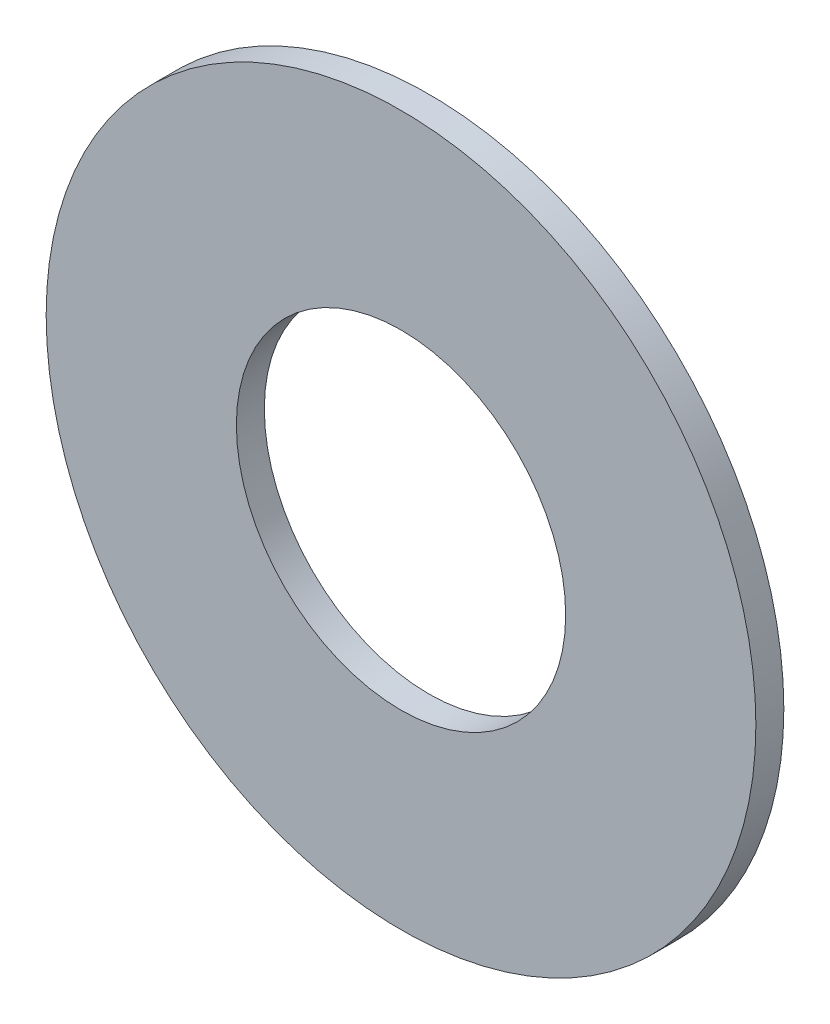
from build123d import *

# Parameters (mm, degrees)
BOSS_EXTRUDE1_DEPTH      = 0.4064
BOSS_EXTRUDE1_DEPTH_BACK = 0.4064
SKETCH3_R                = 10.31875
SKETCH3_R_2              = 4.7879


with BuildPart() as part:
    # Sketch3 → Boss-Extrude1 (new, two sides: drawn at the far end of the back side and taken through both)
    with BuildSketch(Plane.XY.offset(-BOSS_EXTRUDE1_DEPTH_BACK)):
        Circle(SKETCH3_R)
        Circle(SKETCH3_R_2, mode=Mode.SUBTRACT)
    extrude(amount=BOSS_EXTRUDE1_DEPTH + BOSS_EXTRUDE1_DEPTH_BACK)


solid = part.part
